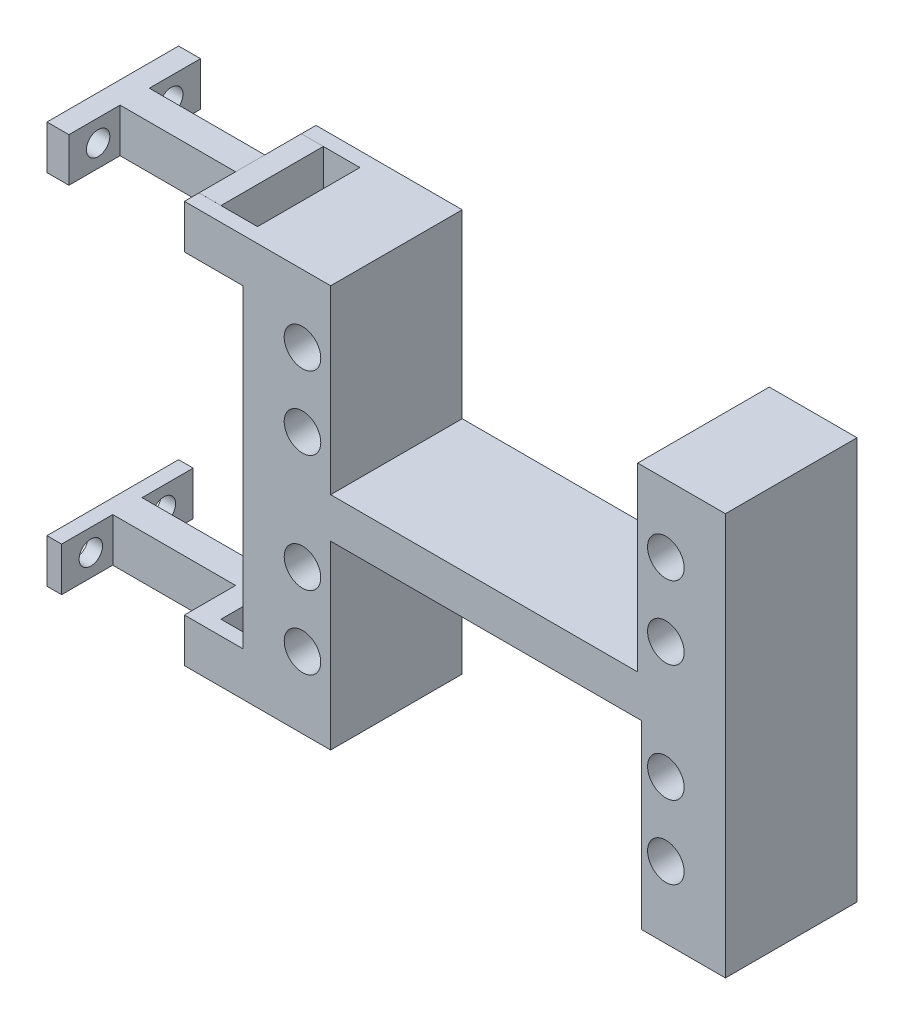
from build123d import *

# Parameters (mm, degrees)
SKETCH2_W               = 66
SKETCH2_H               = 55
SKETCH2_W_2             = 42
SKETCH2_H_2             = 20.5
SKETCH2_W_3             = 42.5
BOSS_EXTRUDE1_DEPTH     = 18
SKETCH3_R               = 2.5
CUT_EXTRUDE1_DEPTH      = 10
SKETCH5_W               = 2
SKETCH5_H               = 6
BOSS_EXTRUDE2_DEPTH     = 26.8
BOSS_EXTRUDE3_REACH     = 89.39
SKETCH6_W               = 3
SKETCH6_H               = 6
SKETCH6_W_2             = 2
SKETCH7_R               = 1.6
CUT_EXTRUDE2_DEPTH      = 10
CUT_EXTRUDE3_REACH      = 89.778
SKETCH8_W               = 42
SKETCH8_H               = 4.25
SKETCH8_W_2             = 42.5
SKETCH9_W               = 3
SKETCH9_H               = 6
BOSS_EXTRUDE5_DEPTH     = 14
CUT_EXTRUDE4_DEPTH      = 21
CUT_EXTRUDE4_DEPTH_BACK = 10
SKETCH10_W              = 15.8
SKETCH10_H              = 6.002189295
SKETCH11_W              = 4
SKETCH11_H              = 6
BOSS_EXTRUDE6_DEPTH     = 15.8
SKETCH12_W              = 3
SKETCH12_H              = 6
BOSS_EXTRUDE7_DEPTH     = 14
CUT_EXTRUDE5_DEPTH      = 18
CUT_EXTRUDE5_DEPTH_BACK = 10
SKETCH13_W              = 16.8
SKETCH13_H              = 6
SKETCH14_W              = 4
SKETCH14_H              = 6
BOSS_EXTRUDE8_DEPTH     = 16.8


with BuildPart() as part:
    # Sketch2 → Boss-Extrude1 (new body)
    with BuildSketch(Plane.XY):
        with Locations((33, 27.5)):
            Rectangle(SKETCH2_W, SKETCH2_H)
        with Locations((33, 40.5)):
            Rectangle(SKETCH2_W_2, SKETCH2_H_2, mode=Mode.SUBTRACT)
        with Locations((33.25, 14.5)):
            Rectangle(SKETCH2_W_3, SKETCH2_H_2, mode=Mode.SUBTRACT)
    extrude(amount=BOSS_EXTRUDE1_DEPTH)

    # Sketch3 → Cut-Extrude1 (cut)
    with BuildSketch(Plane.XY.offset(18)):
        with Locations((8.15, 45.75)):
            Circle(SKETCH3_R)
        with Locations((8.15, 35.75)):
            Circle(SKETCH3_R)
        with Locations(Location((57.85, 35.75, 0), (0, 0, 180))):
            Circle(SKETCH3_R)
        with Locations(Location((57.85, 45.75, 0), (0, 0, 180))):
            Circle(SKETCH3_R)
        with Locations(Location((8.15, 19.75, 0), (0, 0, 180))):
            Circle(SKETCH3_R)
        with Locations(Location((8.15, 9.75, 0), (0, 0, 180))):
            Circle(SKETCH3_R)
        with Locations((57.85, 9.75)):
            Circle(SKETCH3_R)
        with Locations((57.85, 19.75)):
            Circle(SKETCH3_R)
    extrude(amount=-CUT_EXTRUDE1_DEPTH, mode=Mode.SUBTRACT)

    # Sketch5 → Boss-Extrude2 (add)
    with BuildSketch(Plane.ZY):
        with Locations((1, 52)):
            Rectangle(SKETCH5_W, SKETCH5_H)
        with Locations((17, 52)):
            Rectangle(SKETCH5_W, SKETCH5_H)
        with Locations((1, 3)):
            Rectangle(SKETCH5_W, SKETCH5_H)
        with Locations((17, 3)):
            Rectangle(SKETCH5_W, SKETCH5_H)
    extrude(amount=BOSS_EXTRUDE2_DEPTH)

    # Sketch6 → Boss-Extrude3 (add, up to next)
    with BuildSketch(Plane.XY.offset(2), mode=Mode.PRIVATE) as boss_extrude3_sk1:
        with Locations((-25.3, 52)):
            Rectangle(SKETCH6_W, SKETCH6_H)
    boss_extrude3_tool1 = extrude(boss_extrude3_sk1.sketch, amount=BOSS_EXTRUDE3_REACH, mode=Mode.PRIVATE) - part.part
    # Sketch6 → Boss-Extrude3 (add, up to next)
    with BuildSketch(Plane.XY.offset(2), mode=Mode.PRIVATE) as boss_extrude3_sk2:
        with Locations((-25.8, 3)):
            Rectangle(SKETCH6_W_2, SKETCH6_H)
    boss_extrude3_tool2 = extrude(boss_extrude3_sk2.sketch, amount=BOSS_EXTRUDE3_REACH, mode=Mode.PRIVATE) - part.part
    add(boss_extrude3_tool1.solids().sort_by_distance((-25.3, 52, 2))[0])
    add(boss_extrude3_tool2.solids().sort_by_distance((-25.8, 3, 2))[0])

    # Sketch7 → Cut-Extrude2 (cut)
    with BuildSketch(Plane.ZY.offset(26.8)):
        with Locations((4, 52)):
            Circle(SKETCH7_R)
        with Locations((14, 52)):
            Circle(SKETCH7_R)
        with Locations((4, 3)):
            Circle(SKETCH7_R)
        with Locations((14, 3)):
            Circle(SKETCH7_R)
    extrude(amount=-CUT_EXTRUDE2_DEPTH, mode=Mode.SUBTRACT)

    # Sketch8 → Cut-Extrude3 (cut, up to next)
    with BuildSketch(Plane.XY.offset(18), mode=Mode.PRIVATE) as cut_extrude3_sk1:
        with Locations((33, 52.875)):
            Rectangle(SKETCH8_W, SKETCH8_H)
    cut_extrude3_tool1 = extrude(cut_extrude3_sk1.sketch, amount=-CUT_EXTRUDE3_REACH, mode=Mode.PRIVATE) & part.part
    # Sketch8 → Cut-Extrude3 (cut, up to next)
    with BuildSketch(Plane.XY.offset(18), mode=Mode.PRIVATE) as cut_extrude3_sk2:
        with Locations((33.25, 2.125)):
            Rectangle(SKETCH8_W_2, SKETCH8_H)
    cut_extrude3_tool2 = extrude(cut_extrude3_sk2.sketch, amount=-CUT_EXTRUDE3_REACH, mode=Mode.PRIVATE) & part.part
    add(cut_extrude3_tool1.solids().sort_by_distance((33, 52.875, 18))[0], mode=Mode.SUBTRACT)
    add(cut_extrude3_tool2.solids().sort_by_distance((33.25, 2.125, 18))[0], mode=Mode.SUBTRACT)

    # Sketch9 → Boss-Extrude5 (add)
    with BuildSketch(Plane.XY.offset(2)):
        with Locations((-6.5, 52.002189295)):
            Rectangle(SKETCH9_W, SKETCH9_H)
    extrude(amount=BOSS_EXTRUDE5_DEPTH)

    # Sketch10 → Cut-Extrude4 (cut, two sides: drawn at the far end of the back side and taken through both)
    with BuildSketch(Plane(origin=(0, 0, 16), x_dir=(-1, 0, 0), z_dir=(0, 0, -1)).offset(-CUT_EXTRUDE4_DEPTH_BACK)):
        with Locations((15.9, 52.001094647)):
            Rectangle(SKETCH10_W, SKETCH10_H)
    extrude(amount=CUT_EXTRUDE4_DEPTH + CUT_EXTRUDE4_DEPTH_BACK, mode=Mode.SUBTRACT)


with BuildPart() as cut_extrude4_piece_1:
    # of the separate pieces the step leaves, piece 1, a body of its own (cut_extrude4_pieces)
    add(part.part.solids().sort_by_distance((12, 55, 0))[0])



with BuildPart() as cut_extrude4_piece_2:
    # of the separate pieces the step leaves, piece 2, a body of its own (cut_extrude4_pieces)
    add(part.part.solids().sort_by_distance((-23.8, 55, 0))[0])


with BuildPart() as cut_extrude4_piece_1_1:
    add(cut_extrude4_piece_1.part)

    add(cut_extrude4_piece_2.part)  # Boss-Extrude6 merges Cut-Extrude4 piece 2
    # Sketch11 → Boss-Extrude6 (add)
    with BuildSketch(Plane.ZY.offset(8)):
        with Locations((9, 52)):
            Rectangle(SKETCH11_W, SKETCH11_H)
    extrude(amount=BOSS_EXTRUDE6_DEPTH)

    # Sketch12 → Boss-Extrude7 (add)
    with BuildSketch(Plane.XY.offset(2)):
        with Locations((-6.5, 3)):
            Rectangle(SKETCH12_W, SKETCH12_H)
    extrude(amount=BOSS_EXTRUDE7_DEPTH)

    # Sketch13 → Cut-Extrude5 (cut, two sides: drawn at the far end of the back side and taken through both)
    with BuildSketch(Plane(origin=(0, 0, 16), x_dir=(-1, 0, 0), z_dir=(0, 0, -1)).offset(-CUT_EXTRUDE5_DEPTH_BACK)):
        with Locations((16.4, 3)):
            Rectangle(SKETCH13_W, SKETCH13_H)
    extrude(amount=CUT_EXTRUDE5_DEPTH + CUT_EXTRUDE5_DEPTH_BACK, mode=Mode.SUBTRACT)


with BuildPart() as cut_extrude5_piece_1:
    # of the separate pieces the step leaves, piece 1, a body of its own (cut_extrude5_pieces)
    add(cut_extrude4_piece_1_1.part.solids().sort_by_distance((-23.8, 55, 0))[0])



with BuildPart() as cut_extrude5_piece_2:
    # of the separate pieces the step leaves, piece 2, a body of its own (cut_extrude5_pieces)
    add(cut_extrude4_piece_1_1.part.solids().sort_by_distance((-24.8, 0, 18))[0])


with BuildPart() as cut_extrude5_piece_1_1:
    add(cut_extrude5_piece_1.part)

    add(cut_extrude5_piece_2.part)  # Boss-Extrude8 merges Cut-Extrude5 piece 2
    # Sketch14 → Boss-Extrude8 (add)
    with BuildSketch(Plane.ZY.offset(8)):
        with Locations((9, 3)):
            Rectangle(SKETCH14_W, SKETCH14_H)
    extrude(amount=BOSS_EXTRUDE8_DEPTH)


solid = cut_extrude5_piece_1_1.part
